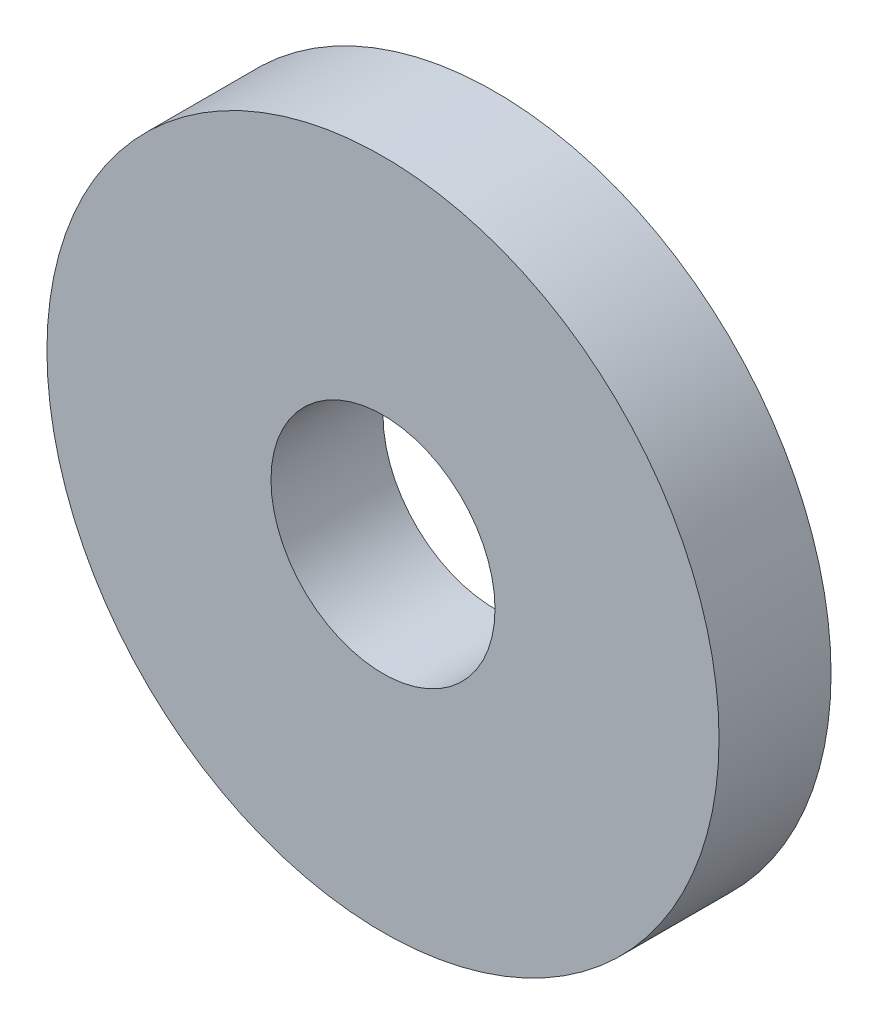
from build123d import *

# Parameters (mm, degrees)
CROQUIS1_R              = 7.5
CROQUIS1_R_2            = 2.5
SALIENTE_EXTRUIR1_DEPTH = 2.5


with BuildPart() as part:
    # Croquis1 → Saliente-Extruir1 (new body)
    with BuildSketch(Plane.XY):
        Circle(CROQUIS1_R)
        Circle(CROQUIS1_R_2, mode=Mode.SUBTRACT)
    extrude(amount=SALIENTE_EXTRUIR1_DEPTH)


solid = part.part
